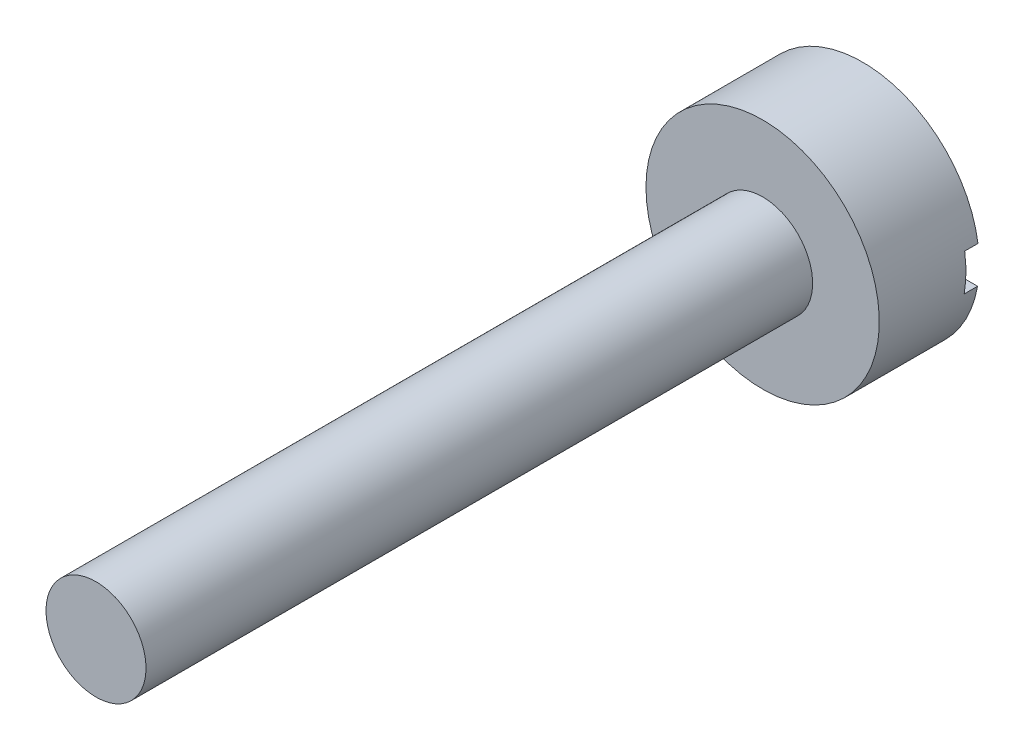
from build123d import *

# Parameters (mm, degrees)
CUT_EXTRUDE1_DEPTH = 127


with BuildPart() as part:
    # Sketch2 → Revolve1 (revolve)
    with BuildSketch(Plane(origin=(0, 0, 0), x_dir=(1, 0, 0), z_dir=(0, 1, 0)), mode=Mode.PRIVATE) as revolve1_sk:
        Polygon((0, 0), (1.905, 0), (1.905, 25.4), (4.445, 25.4), (4.445, 29.21), (0, 29.21), align=None)
    revolve(revolve1_sk.sketch.rotate(Axis((0, 0, -29.21), (0, 0, 1)), 180), axis=Axis((0, 0, -29.21), (0, 0, 1)))

    # Sketch3 → Cut-Extrude1 (cut, symmetric)
    with BuildSketch(Plane(origin=(0, 0, 0), x_dir=(0, 0, -1), z_dir=(1, 0, 0))):
        Polygon((29.21, 0.657737685), (29.21, 0), (29.21, -0.762), (28.702, -0.762), (28.702, 0.657737685), align=None)
    extrude(amount=CUT_EXTRUDE1_DEPTH, both=True, mode=Mode.SUBTRACT)


solid = part.part
